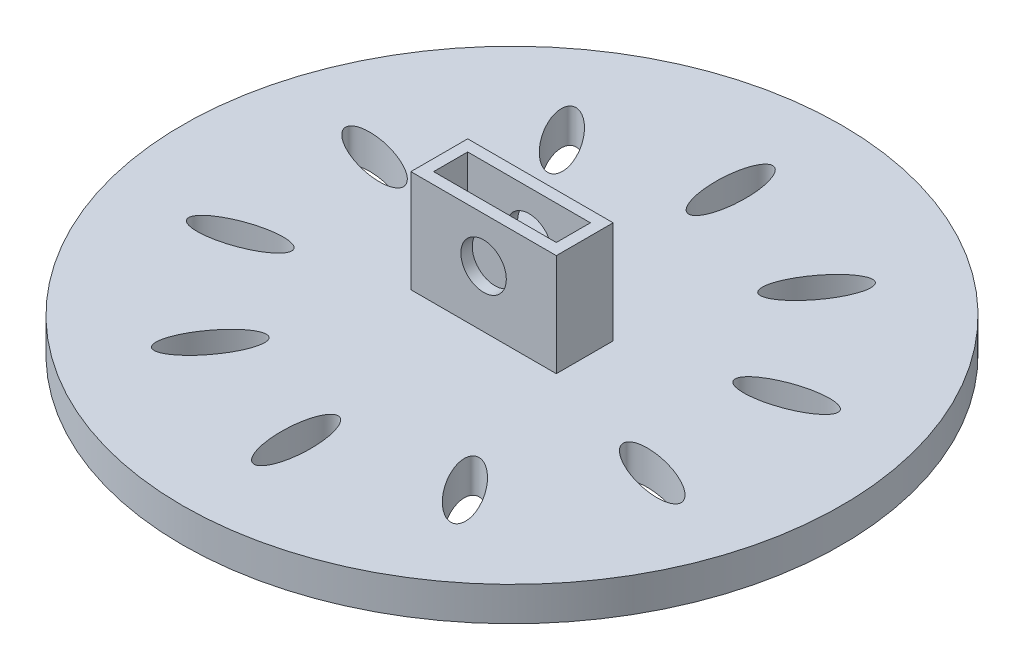
from build123d import *

# Parameters (mm, degrees)
SKETCH2_R               = 145
SKETCH2_RX              = 18.5
SKETCH2_RY              = 6.5
BOSS_EXTRUDE1_DEPTH     = 15
SHELL4_T                = -10
SKETCH3_W               = 64
SKETCH3_H               = 25
SKETCH3_W_2             = 54
SKETCH3_H_2             = 15
BOSS_EXTRUDE2_DEPTH     = 45
CUT_EXTRUDE2_DEPTH      = 214.658606192
CUT_EXTRUDE2_DEPTH_BACK = 214.658606192
SKETCH5_R               = 10


with BuildPart() as part:
    # Sketch2 → Boss-Extrude1 (new body)
    with BuildSketch(Plane(origin=(0, 0, 0), x_dir=(1, 0, 0), z_dir=(0, 1, 0))):
        with Locations(Location((0, 0, 0), (0, 0, 270))):
            Circle(SKETCH2_R)
        with Locations(Location((0, -95), (0, 0, 90))):
            Ellipse(SKETCH2_RX, SKETCH2_RY, mode=Mode.SUBTRACT)
        with Locations(Location((-56.083322213, -76.678947368), (0, 0, -126))):
            Ellipse(SKETCH2_RX, SKETCH2_RY, mode=Mode.SUBTRACT)
        with Locations(Location((-90.686838441, -28.891954738), (0, 0, 18))):
            Ellipse(SKETCH2_RX, SKETCH2_RY, mode=Mode.SUBTRACT)
        with Locations(Location((-90.593181616, 30.107970926), (0, 0, 162))):
            Ellipse(SKETCH2_RX, SKETCH2_RY, mode=Mode.SUBTRACT)
        with Locations(Location((-55.83812546, 77.784863355), (0, 0, 126))):
            Ellipse(SKETCH2_RX, SKETCH2_RY, mode=Mode.SUBTRACT)
        with Locations(Location((0.303079855, 95.927770117), (0, 0, -90))):
            Ellipse(SKETCH2_RX, SKETCH2_RY, mode=Mode.SUBTRACT)
        with Locations(Location((56.386402068, 77.606717486), (0, 0, -126))):
            Ellipse(SKETCH2_RX, SKETCH2_RY, mode=Mode.SUBTRACT)
        with Locations(Location((90.989918296, 29.819724855), (0, 0, -162))):
            Ellipse(SKETCH2_RX, SKETCH2_RY, mode=Mode.SUBTRACT)
        with Locations(Location((90.89626147, -29.180200809), (0, 0, 162))):
            Ellipse(SKETCH2_RX, SKETCH2_RY, mode=Mode.SUBTRACT)
        with Locations(Location((56.141205315, -76.857093237), (0, 0, -54))):
            Ellipse(SKETCH2_RX, SKETCH2_RY, mode=Mode.SUBTRACT)
    extrude(amount=BOSS_EXTRUDE1_DEPTH)

    # Shell4
    shell4_openings = [part.faces().sort_by_distance(p)[0] for p in [
        (-0.009192925, 0, 0.028140839),
    ]]
    offset(amount=SHELL4_T, openings=shell4_openings, kind=Kind.INTERSECTION)

    # Sketch3 → Boss-Extrude2 (add)
    with BuildSketch(Plane(origin=(0, 15, 0), x_dir=(1, 0, 0), z_dir=(0, 1, 0))):
        Rectangle(SKETCH3_W, SKETCH3_H)
        Rectangle(SKETCH3_W_2, SKETCH3_H_2, mode=Mode.SUBTRACT)
    extrude(amount=BOSS_EXTRUDE2_DEPTH)

    # Sketch5 → Cut-Extrude2 (cut, two sides: drawn at the far end of the back side and taken through both)
    with BuildSketch(Plane.XY.offset(-CUT_EXTRUDE2_DEPTH_BACK)):
        with Locations((0, 40)):
            Circle(SKETCH5_R)
    extrude(amount=CUT_EXTRUDE2_DEPTH + CUT_EXTRUDE2_DEPTH_BACK, mode=Mode.SUBTRACT)


solid = part.part
